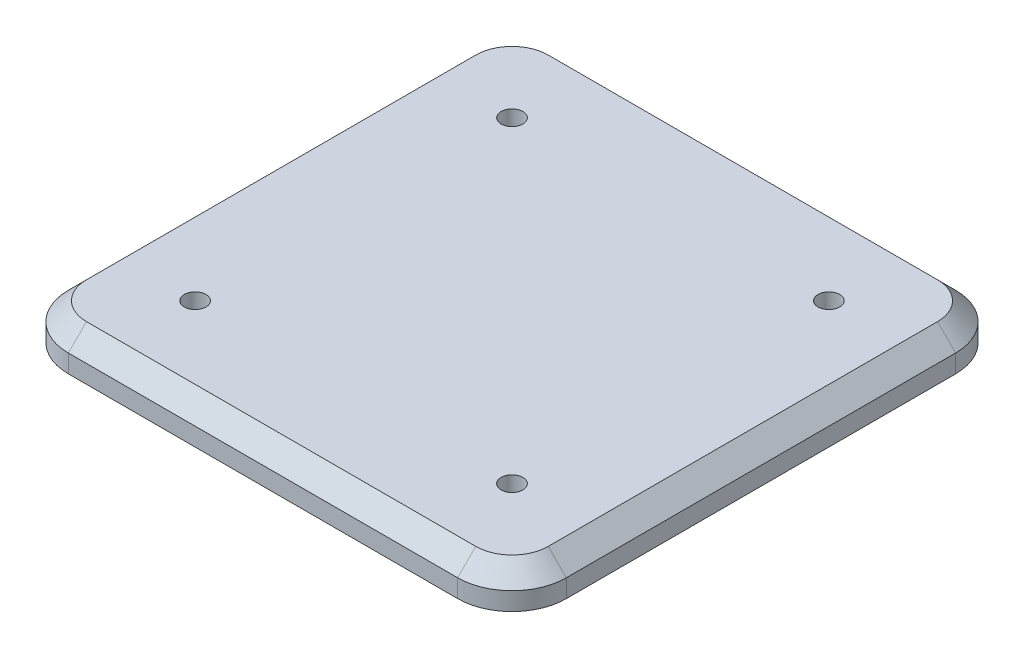
from build123d import *

# Parameters (mm, degrees)
SKETCH_1_W          = 275
SKETCH_1_H          = 275
EXTRUDE_1_DEPTH     = 20
FILLET_1_R          = 30
CHAMFER_1_SIZE      = 10
HOLE_WIZARD_1_D     = 12
HOLE_WIZARD_1_DEPTH = 10
HOLE_WIZARD_1_TIP   = 3.605163714
HOLE_WIZARD_2_D     = 12
HOLE_WIZARD_2_DEPTH = 10
HOLE_WIZARD_2_TIP   = 3.605163714


with BuildPart() as part:
    # 草圖1 → 擠出1 (new body)
    with BuildSketch(Plane(origin=(0, 0, 0), x_dir=(-1, 0, 0), z_dir=(0, 1, 0))):
        Rectangle(SKETCH_1_W, SKETCH_1_H)
    extrude(amount=EXTRUDE_1_DEPTH)

    # 圓角1
    fillet_1_edges = [part.edges().sort_by_distance(p)[0] for p in [
        (-137.5, 10, -137.5),
        (137.5, 10, -137.5),
        (137.5, 10, 137.5),
        (-137.5, 10, 137.5),
    ]]
    fillet(fillet_1_edges, radius=FILLET_1_R)

    # 倒角1
    chamfer_1_edges = [part.edges().sort_by_distance(p)[0] for p in [
        (137.5, 20, 0),
        (0, 20, 137.5),
        (-137.5, 20, 0),
        (0, 20, -137.5),
        (-128.713203436, 20, 128.713203436),
        (-128.713203436, 20, -128.713203436),
        (128.713203436, 20, -128.713203436),
        (128.713203436, 20, 128.713203436),
    ]]
    chamfer(chamfer_1_edges, length=CHAMFER_1_SIZE)

    # 孔1
    with Locations(Plane(origin=(0, 0, 0), x_dir=(-1, 0, 0), z_dir=(0, -1, 0))):
        with Locations((-112.5, -112.5), (-112.5, 112.5), (112.5, 112.5), (112.5, -112.5)):
            Hole(HOLE_WIZARD_1_D / 2, depth=HOLE_WIZARD_1_DEPTH)
            with Locations((0, 0, -(HOLE_WIZARD_1_DEPTH + HOLE_WIZARD_1_TIP / 2))):  # 118° drill point
                Cone(0, HOLE_WIZARD_1_D / 2, HOLE_WIZARD_1_TIP, mode=Mode.SUBTRACT)

    # 孔2
    with Locations(Plane(origin=(0, 20, 0), x_dir=(1, 0, 0), z_dir=(0, 1, 0))):
        with Locations((-87.5, 87.5), (87.5, 87.5), (87.5, -87.5), (-87.5, -87.5)):
            Hole(HOLE_WIZARD_2_D / 2, depth=HOLE_WIZARD_2_DEPTH)
            with Locations((0, 0, -(HOLE_WIZARD_2_DEPTH + HOLE_WIZARD_2_TIP / 2))):  # 118° drill point
                Cone(0, HOLE_WIZARD_2_D / 2, HOLE_WIZARD_2_TIP, mode=Mode.SUBTRACT)


solid = part.part
